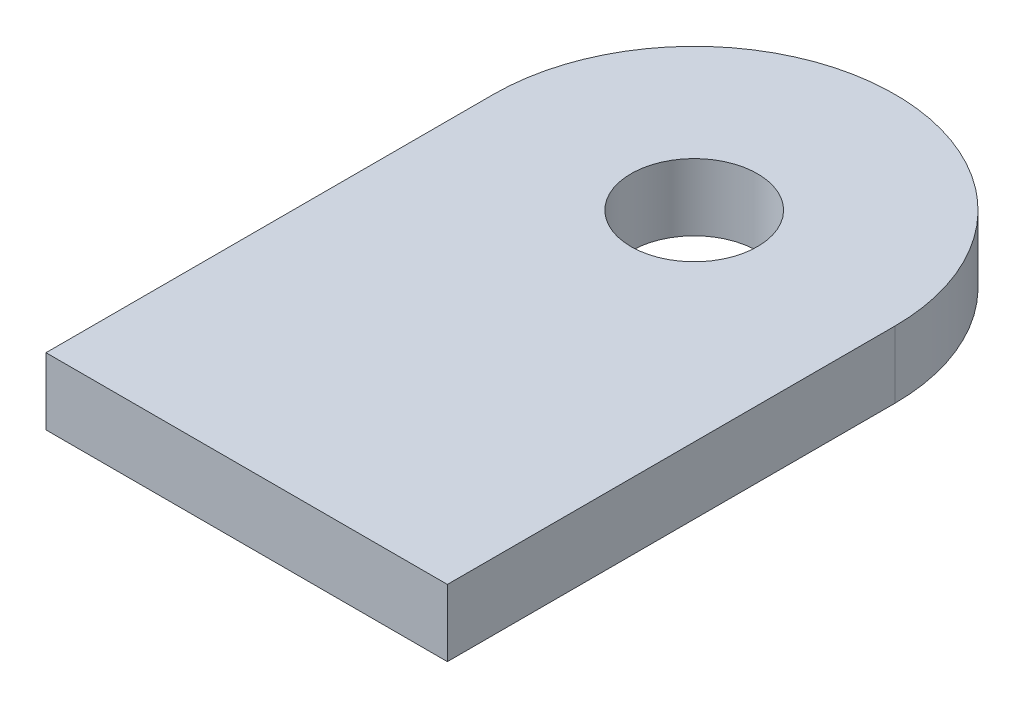
from build123d import *

# Parameters (mm, degrees)
SKETCH1_R           = 3
BOSS_EXTRUDE1_DEPTH = 3.175


with BuildPart() as part:
    # Sketch1 → Boss-Extrude1 (new body)
    with BuildSketch(Plane(origin=(0, 0, 0), x_dir=(1, 0, 0), z_dir=(0, 1, 0))):
        with BuildLine():
            Line((-9.525, 0), (-9.525, -21.24))
            Line((-9.525, -21.24), (9.525, -21.24))
            Line((9.525, -21.24), (9.525, 0))
            ThreePointArc((9.525, 0), (0, 9.525), (-9.525, 0))
        make_face()
        with Locations(Location((0, 0, 0), (0, 0, 270))):
            Circle(SKETCH1_R, mode=Mode.SUBTRACT)
    extrude(amount=BOSS_EXTRUDE1_DEPTH)


solid = part.part
